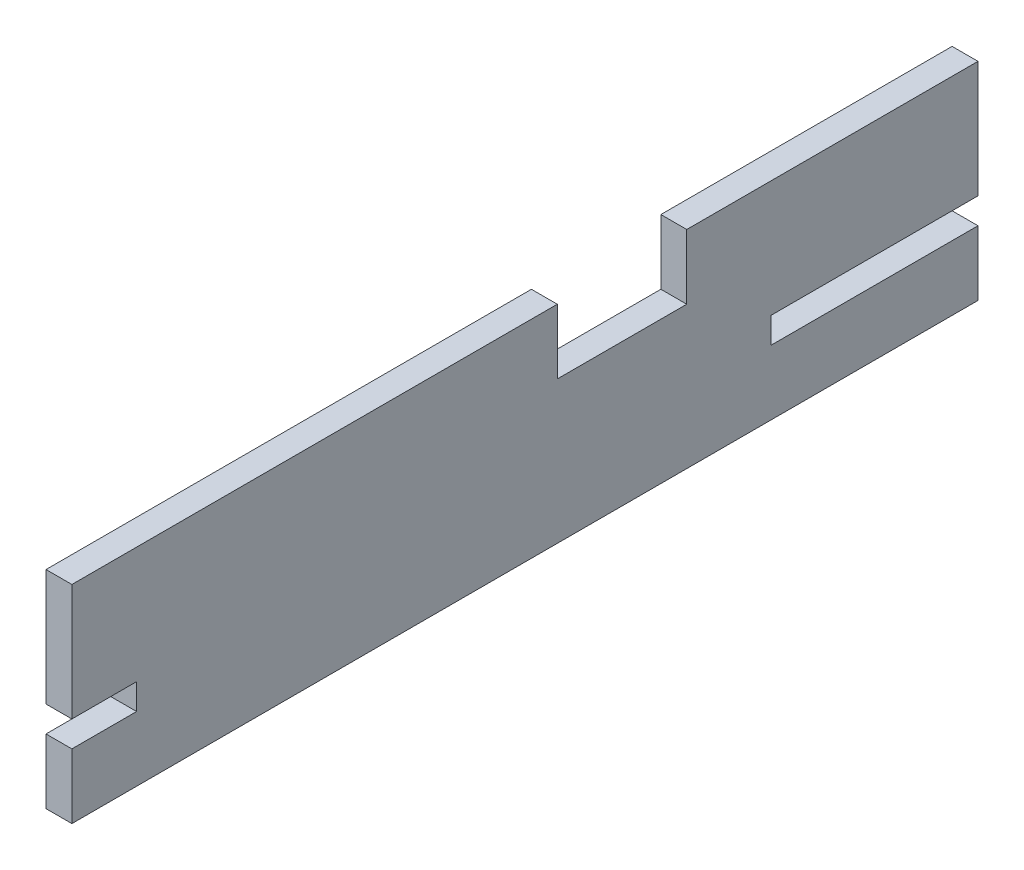
from build123d import *

# Parameters (mm, degrees)
BOSS_EXTRUDE1_DEPTH = 4


with BuildPart() as part:
    # Sketch1 → Boss-Extrude1 (new body)
    with BuildSketch(Plane(origin=(0, 0, 0), x_dir=(0, 0, -1), z_dir=(1, 0, 0))):
        Polygon((-59.681566678, 15.561183988), (-59.681566678, -2.438816012), (-49.681566678, -2.438816012), (-49.681566678, -6.438816012), (-59.681566678, -6.438816012), (-59.681566678, -16.438816012), (80.318433322, -16.438816012), (80.318433322, -6.438816012), (48.318433322, -6.438816012), (48.318433322, -2.438816012), (80.318433322, -2.438816012), (80.318433322, 15.561183988), (35.318433322, 15.561183988), (35.318433322, 5.561183988), (15.318433322, 5.561183988), (15.318433322, 15.561183988), align=None)
    extrude(amount=BOSS_EXTRUDE1_DEPTH)


solid = part.part
